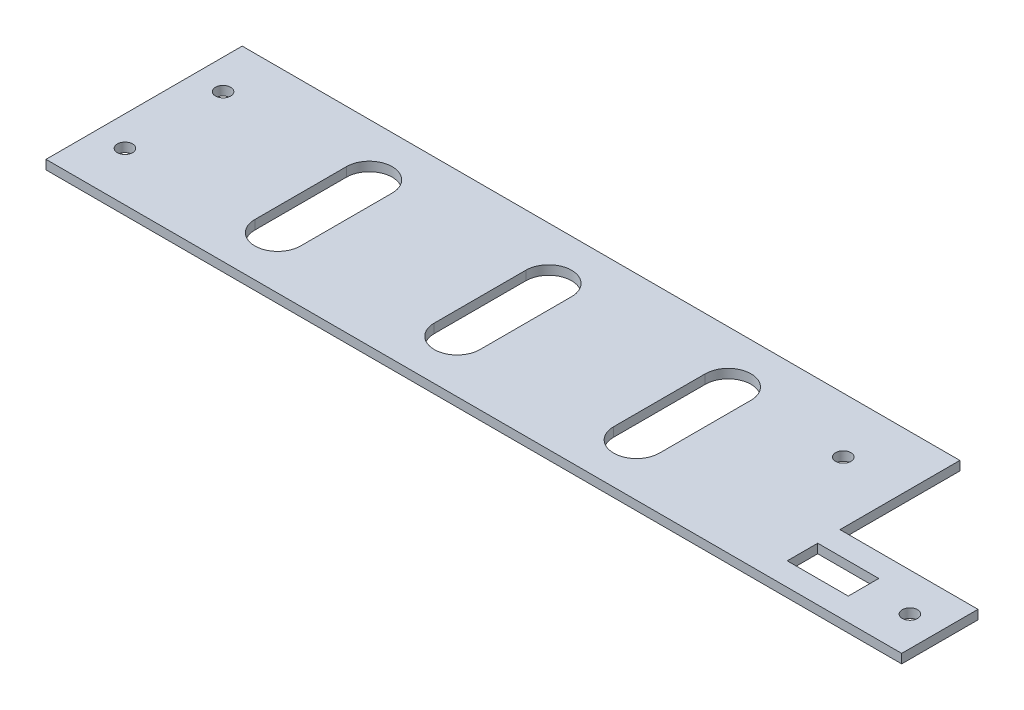
from build123d import *

# Parameters (mm, degrees)
ESQUISSE1_R             = 2.5
BOSS_EXTRU_1_DEPTH      = 3
ESQUISSE2_W             = 20
ESQUISSE2_H             = 10
ENL_V_MAT_EXTRU_1_DEPTH = 174.720827721


with BuildPart() as part:
    # Esquisse1 → Boss.-Extru.1 (new body)
    with BuildSketch(Plane(origin=(0, 0, 0), x_dir=(1, 0, 0), z_dir=(0, 1, 0))):
        Polygon((-170.028456395, 18.77), (-170.028456395, -23), (-170.028456395, -35.5), (110.271543605, -35.5), (110.271543605, -10.5), (65.057787015, -10.5), (65.057787015, 28.77), (-170.028456395, 28.77), align=None)
        with Locations(Location((100.471543605, -23, 0), (0, 0, 270))):
            Circle(ESQUISSE1_R, mode=Mode.SUBTRACT)
        with Locations(Location((-160.228456395, -19.4325, 0), (0, 0, 270))):
            Circle(ESQUISSE1_R, mode=Mode.SUBTRACT)
        with Locations(Location((-160.228456395, 12.7025, 0), (0, 0, 270))):
            Circle(ESQUISSE1_R, mode=Mode.SUBTRACT)
        with Locations(Location((45.007787015, 10.635, 0), (0, 0, 270))):
            Circle(ESQUISSE1_R, mode=Mode.SUBTRACT)
    extrude(amount=BOSS_EXTRU_1_DEPTH)

    # Esquisse2 → Enlèv. mat.-Extru.1 (cut, through all)
    with BuildSketch(Plane(origin=(0, 3, 0), x_dir=(1, 0, 0), z_dir=(0, 1, 0))):
        with BuildLine():
            Line((-118.756895542, 11.635), (-118.756895542, -18.365))
            ThreePointArc((-118.756895542, -18.365), (-111.256895542, -25.865), (-103.756895542, -18.365))
            Line((-103.756895542, -18.365), (-103.756895542, 11.635))
            ThreePointArc((-103.756895542, 11.635), (-111.256895542, 19.135), (-118.756895542, 11.635))
        make_face()
        with BuildLine():
            Line((-59.98533469, 11.635), (-59.98533469, -18.365))
            ThreePointArc((-59.98533469, -18.365), (-52.48533469, -25.865), (-44.98533469, -18.365))
            Line((-44.98533469, -18.365), (-44.98533469, 11.635))
            ThreePointArc((-44.98533469, 11.635), (-52.48533469, 19.135), (-59.98533469, 11.635))
        make_face()
        with BuildLine():
            Line((-1.213773837, 11.635), (-1.213773837, -18.365))
            ThreePointArc((-1.213773837, -18.365), (6.286226163, -25.865), (13.786226163, -18.365))
            Line((13.786226163, -18.365), (13.786226163, 11.635))
            ThreePointArc((13.786226163, 11.635), (6.286226163, 19.135), (-1.213773837, 11.635))
        make_face()
        with Locations((75.271543605, -23)):
            Rectangle(ESQUISSE2_W, ESQUISSE2_H)
    extrude(amount=-ENL_V_MAT_EXTRU_1_DEPTH, mode=Mode.SUBTRACT)


solid = part.part
